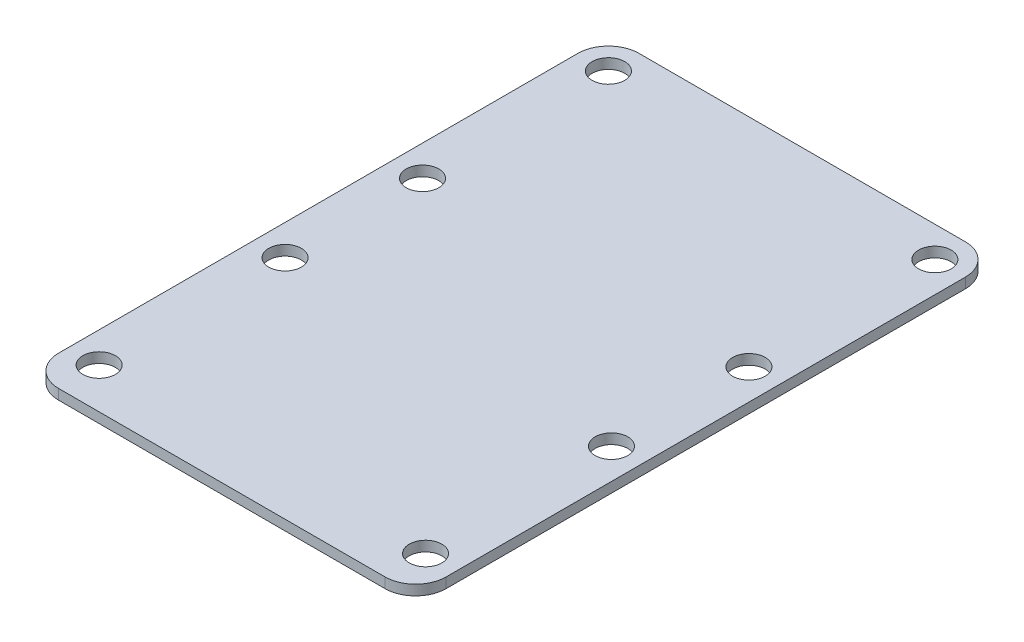
from build123d import *

# Parameters (mm, degrees)
SKETCH2_W           = 38.06
SKETCH2_H           = 57
SKETCH2_R           = 1.53
BOSS_EXTRUDE1_DEPTH = 1
FILLET2_R           = 3
SKETCH4_R           = 1.6
CUT_EXTRUDE1_DEPTH  = 69.54606918


with BuildPart() as part:
    # Sketch2 → Boss-Extrude1 (new body)
    with BuildSketch(Plane(origin=(0, 0, 0), x_dir=(1, 0, 0), z_dir=(0, 1, 0))):
        with Locations((19.03, -28.5)):
            Rectangle(SKETCH2_W, SKETCH2_H)
        with Locations(Location((3, -3, 0), (0, 0, 270))):
            Circle(SKETCH2_R, mode=Mode.SUBTRACT)
        with Locations(Location((3, -21.26, 0), (0, 0, 270))):
            Circle(SKETCH2_R, mode=Mode.SUBTRACT)
        with Locations(Location((3, -34.76, 0), (0, 0, 270))):
            Circle(SKETCH2_R, mode=Mode.SUBTRACT)
        with Locations(Location((3, -53.02, 0), (0, 0, 270))):
            Circle(SKETCH2_R, mode=Mode.SUBTRACT)
        with Locations(Location((35.06, -53.02, 0), (0, 0, 270))):
            Circle(SKETCH2_R, mode=Mode.SUBTRACT)
        with Locations(Location((35.06, -34.76, 0), (0, 0, 270))):
            Circle(SKETCH2_R, mode=Mode.SUBTRACT)
        with Locations(Location((35.06, -21.26, 0), (0, 0, 270))):
            Circle(SKETCH2_R, mode=Mode.SUBTRACT)
        with Locations(Location((35.06, -3, 0), (0, 0, 270))):
            Circle(SKETCH2_R, mode=Mode.SUBTRACT)
    extrude(amount=BOSS_EXTRUDE1_DEPTH)

    # Fillet2
    fillet2_edges = [part.edges().sort_by_distance(p)[0] for p in [
        (38.06, 0.5, 57),
        (0, 0.5, 57),
        (0, 0.5, 0),
        (38.06, 0.5, 0),
    ]]
    fillet(fillet2_edges, radius=FILLET2_R)

    # Sketch4 → Cut-Extrude1 (cut, through all)
    with BuildSketch(Plane(origin=(0, 1, 0), x_dir=(1, 0, 0), z_dir=(0, 1, 0))):
        with Locations(Location((3, -3, 0), (0, 0, 270))):
            Circle(SKETCH4_R)
        with Locations(Location((3, -21.26, 0), (0, 0, 270))):
            Circle(SKETCH4_R)
        with Locations(Location((35.06, -3, 0), (0, 0, 270))):
            Circle(SKETCH4_R)
        with Locations(Location((35.06, -21.26, 0), (0, 0, 270))):
            Circle(SKETCH4_R)
        with Locations(Location((3, -34.76, 0), (0, 0, 270))):
            Circle(SKETCH4_R)
        with Locations(Location((35.06, -34.76, 0), (0, 0, 270))):
            Circle(SKETCH4_R)
        with Locations(Location((3, -53.02, 0), (0, 0, 270))):
            Circle(SKETCH4_R)
        with Locations(Location((35.06, -53.02, 0), (0, 0, 270))):
            Circle(SKETCH4_R)
    extrude(amount=-CUT_EXTRUDE1_DEPTH, mode=Mode.SUBTRACT)


solid = part.part
